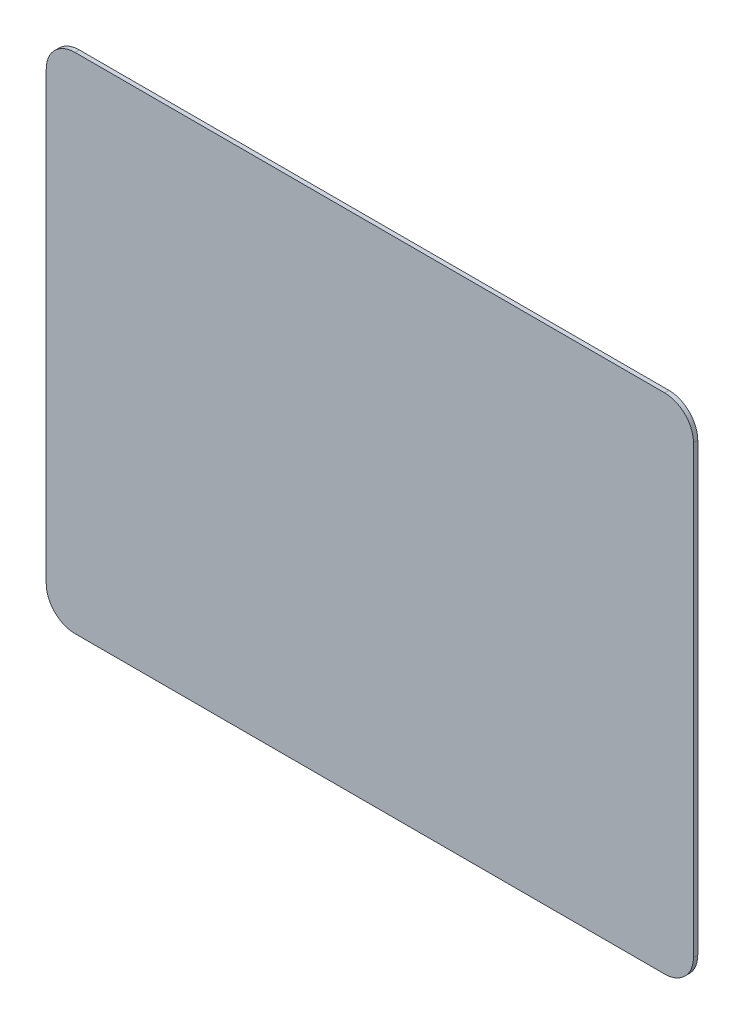
from build123d import *

# Parameters (mm, degrees)
SKETCH_1_W      = 450
SKETCH_1_H      = 350
EXTRUDE_1_DEPTH = 3
FILLET_1_R      = 20


with BuildPart() as part:
    # 草图1 → 凸台-拉伸1 (new body)
    with BuildSketch(Plane.XY):
        Rectangle(SKETCH_1_W, SKETCH_1_H)
    extrude(amount=EXTRUDE_1_DEPTH)

    # 圆角1
    fillet_1_edges = [part.edges().sort_by_distance(p)[0] for p in [
        (-225, 175, 1.5),
        (225, 175, 1.5),
        (225, -175, 1.5),
        (-225, -175, 1.5),
    ]]
    fillet(fillet_1_edges, radius=FILLET_1_R)


solid = part.part
